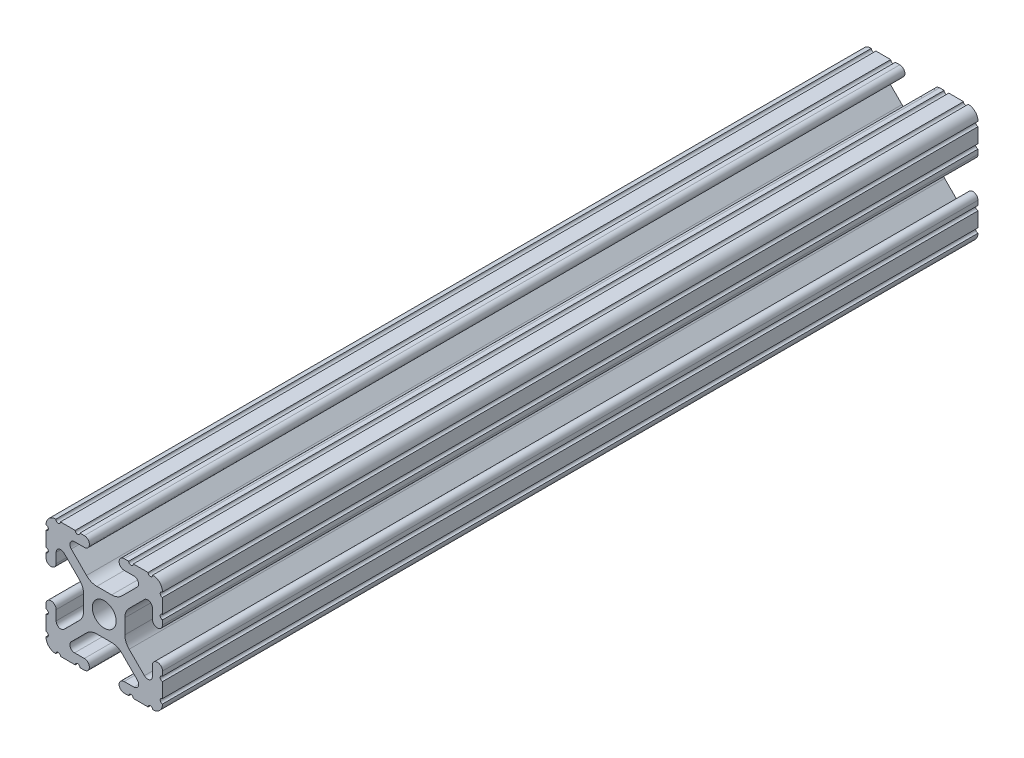
from build123d import *

# Parameters (mm, degrees)
SKETCH1_R           = 2.6035
BOSS_EXTRUDE1_DEPTH = 1270
SKETCH6_W           = 122.666969327
SKETCH6_H           = 109.347800906
CUT_EXTRUDE1_DEPTH  = 699.730870937
SKETCH7_W           = 29.67741712
SKETCH7_H           = 27.72917189
CUT_EXTRUDE2_DEPTH  = 520.7


with BuildPart() as part:
    # Sketch1 → Boss-Extrude1 (new body)
    with BuildSketch(Plane(origin=(0, 0, -1270), x_dir=(-1, 0, 0), z_dir=(0, 0, -1))):
        with BuildLine():
            Line((12.7, -9.5504), (12.7, -6.3330836))
            ThreePointArc((12.7, -6.3330836), (12.192, -5.8250836), (12.7, -5.3170836))
            Line((12.7, -5.3170836), (12.7, -4.3434))
            ThreePointArc((12.7, -4.3434), (11.5951, -3.2385), (10.4902, -4.3434))
            Line((10.4902, -4.3434), (10.4902, -6.474794456))
            ThreePointArc((10.4902, -6.474794456), (9.863006367, -7.413456061), (8.75577951, -7.193214945))
            Line((8.75577951, -7.193214945), (5.42573597, -3.863171405))
            ThreePointArc((5.42573597, -3.863171405), (4.737482484, -2.833127272), (4.4958, -1.618107374))
            Line((4.4958, -1.618107374), (4.4958, 1.618107374))
            ThreePointArc((4.4958, 1.618107374), (4.737482484, 2.833127272), (5.42573597, 3.863171405))
            Line((5.42573597, 3.863171405), (8.75577951, 7.193214945))
            ThreePointArc((8.75577951, 7.193214945), (9.863006367, 7.413456061), (10.4902, 6.474794456))
            Line((10.4902, 6.474794456), (10.4902, 4.343399971))
            ThreePointArc((10.4902, 4.343399971), (11.5951, 3.238499971), (12.7, 4.343399971))
            Line((12.7, 4.343399971), (12.7, 5.3170836))
            ThreePointArc((12.7, 5.3170836), (12.192, 5.8250836), (12.7, 6.3330836))
            Line((12.7, 6.3330836), (12.7, 9.5504))
            ThreePointArc((12.7, 9.5504), (12.192000006, 10.058323491), (12.699846982, 10.566399977))
            ThreePointArc((12.699846982, 10.566399977), (12.082522516, 12.082522516), (10.566399977, 12.699846982))
            ThreePointArc((10.566399977, 12.699846982), (10.058323491, 12.192000006), (9.5504, 12.7))
            Line((9.5504, 12.7), (6.3330836, 12.7))
            ThreePointArc((6.3330836, 12.7), (5.8250836, 12.192), (5.3170836, 12.7))
            Line((5.3170836, 12.7), (4.3434, 12.7))
            ThreePointArc((4.3434, 12.7), (3.2385, 11.5951), (4.3434, 10.4902))
            Line((4.3434, 10.4902), (6.474794456, 10.4902))
            ThreePointArc((6.474794456, 10.4902), (7.413456061, 9.863006367), (7.193214945, 8.75577951))
            Line((7.193214945, 8.75577951), (3.863171405, 5.42573597))
            ThreePointArc((3.863171405, 5.42573597), (2.833127272, 4.737482484), (1.618107374, 4.4958))
            Line((1.618107374, 4.4958), (-1.618107374, 4.4958))
            ThreePointArc((-1.618107374, 4.4958), (-2.833127272, 4.737482484), (-3.863171405, 5.42573597))
            Line((-3.863171405, 5.42573597), (-7.193214945, 8.75577951))
            ThreePointArc((-7.193214945, 8.75577951), (-7.413456061, 9.863006367), (-6.474794456, 10.4902))
            Line((-6.474794456, 10.4902), (-4.343399971, 10.4902))
            ThreePointArc((-4.343399971, 10.4902), (-3.238499971, 11.5951), (-4.343399971, 12.7))
            Line((-4.343399971, 12.7), (-5.3170836, 12.7))
            ThreePointArc((-5.3170836, 12.7), (-5.8250836, 12.192), (-6.3330836, 12.7))
            Line((-6.3330836, 12.7), (-9.5504, 12.7))
            ThreePointArc((-9.5504, 12.7), (-10.058323491, 12.192000006), (-10.566399977, 12.699846982))
            ThreePointArc((-10.566399977, 12.699846982), (-12.082522516, 12.082522516), (-12.699846982, 10.566399977))
            ThreePointArc((-12.699846982, 10.566399977), (-12.192000006, 10.058323491), (-12.7, 9.5504))
            Line((-12.7, 9.5504), (-12.7, 6.3330836))
            ThreePointArc((-12.7, 6.3330836), (-12.192, 5.8250836), (-12.7, 5.3170836))
            Line((-12.7, 5.3170836), (-12.7, 4.3434))
            ThreePointArc((-12.7, 4.3434), (-11.5951, 3.2385), (-10.4902, 4.3434))
            Line((-10.4902, 4.3434), (-10.4902, 6.474794456))
            ThreePointArc((-10.4902, 6.474794456), (-9.863006367, 7.413456061), (-8.75577951, 7.193214945))
            Line((-8.75577951, 7.193214945), (-5.42573597, 3.863171405))
            ThreePointArc((-5.42573597, 3.863171405), (-4.737482484, 2.833127272), (-4.4958, 1.618107374))
            Line((-4.4958, 1.618107374), (-4.4958, -1.618107374))
            ThreePointArc((-4.4958, -1.618107374), (-4.737482484, -2.833127272), (-5.42573597, -3.863171405))
            Line((-5.42573597, -3.863171405), (-8.75577951, -7.193214945))
            ThreePointArc((-8.75577951, -7.193214945), (-9.863006367, -7.413456061), (-10.4902, -6.474794456))
            Line((-10.4902, -6.474794456), (-10.4902, -4.343399971))
            ThreePointArc((-10.4902, -4.343399971), (-11.5951, -3.238499971), (-12.7, -4.343399971))
            Line((-12.7, -4.343399971), (-12.7, -5.3170836))
            ThreePointArc((-12.7, -5.3170836), (-12.192, -5.8250836), (-12.7, -6.3330836))
            Line((-12.7, -6.3330836), (-12.7, -9.5504))
            ThreePointArc((-12.7, -9.5504), (-12.192000006, -10.058323491), (-12.699846982, -10.566399977))
            ThreePointArc((-12.699846982, -10.566399977), (-12.082522516, -12.082522516), (-10.566399977, -12.699846982))
            ThreePointArc((-10.566399977, -12.699846982), (-10.058323491, -12.192000006), (-9.5504, -12.7))
            Line((-9.5504, -12.7), (-6.3330836, -12.7))
            ThreePointArc((-6.3330836, -12.7), (-5.8250836, -12.192), (-5.3170836, -12.7))
            Line((-5.3170836, -12.7), (-4.3434, -12.7))
            ThreePointArc((-4.3434, -12.7), (-3.2385, -11.5951), (-4.3434, -10.4902))
            Line((-4.3434, -10.4902), (-6.474794456, -10.4902))
            ThreePointArc((-6.474794456, -10.4902), (-7.413456061, -9.863006367), (-7.193214945, -8.75577951))
            Line((-7.193214945, -8.75577951), (-3.863171405, -5.42573597))
            ThreePointArc((-3.863171405, -5.42573597), (-2.833127272, -4.737482484), (-1.618107374, -4.4958))
            Line((-1.618107374, -4.4958), (1.618107374, -4.4958))
            ThreePointArc((1.618107374, -4.4958), (2.833127272, -4.737482484), (3.863171405, -5.42573597))
            Line((3.863171405, -5.42573597), (7.193214945, -8.75577951))
            ThreePointArc((7.193214945, -8.75577951), (7.413456061, -9.863006367), (6.474794456, -10.4902))
            Line((6.474794456, -10.4902), (4.343399971, -10.4902))
            ThreePointArc((4.343399971, -10.4902), (3.238499971, -11.5951), (4.343399971, -12.7))
            Line((4.343399971, -12.7), (5.3170836, -12.7))
            ThreePointArc((5.3170836, -12.7), (5.8250836, -12.192), (6.3330836, -12.7))
            Line((6.3330836, -12.7), (9.5504, -12.7))
            ThreePointArc((9.5504, -12.7), (10.058323491, -12.192000006), (10.566399977, -12.699846982))
            ThreePointArc((10.566399977, -12.699846982), (12.082522516, -12.082522516), (12.699846982, -10.566399977))
            ThreePointArc((12.699846982, -10.566399977), (12.192000006, -10.058323491), (12.7, -9.5504))
        make_face()
        Circle(SKETCH1_R, mode=Mode.SUBTRACT)
    extrude(amount=-BOSS_EXTRUDE1_DEPTH)

    # Sketch6 → Cut-Extrude1 (cut, through all)
    with BuildSketch(Plane(origin=(0, 0, -698.5), x_dir=(-1, 0, 0), z_dir=(0, 0, -1))):
        with Locations((17.668938213, -20.549718265)):
            Rectangle(SKETCH6_W, SKETCH6_H)
    extrude(amount=CUT_EXTRUDE1_DEPTH, mode=Mode.SUBTRACT)

    # Sketch7 → Cut-Extrude2 (cut)
    with BuildSketch(Plane.XY):
        Rectangle(SKETCH7_W, SKETCH7_H)
    extrude(amount=-CUT_EXTRUDE2_DEPTH, mode=Mode.SUBTRACT)


solid = part.part
